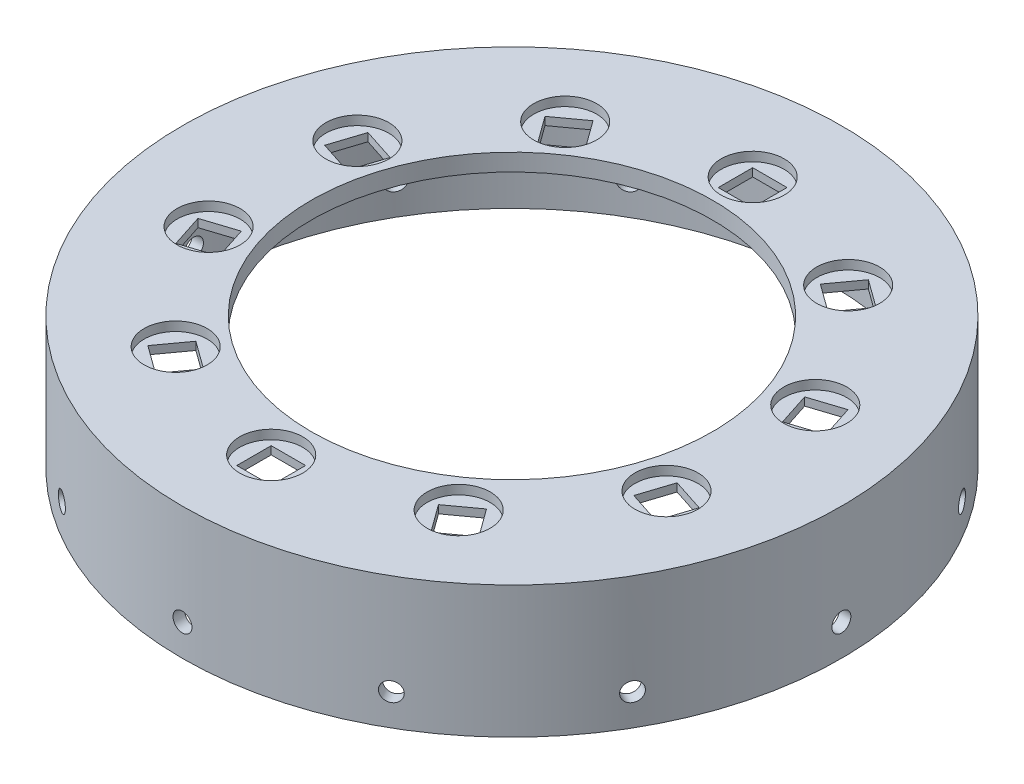
from build123d import *

# Parameters (mm, degrees)
SKETCH1_R           = 57.5
SKETCH1_R_2         = 55.5
BOSS_EXTRUDE1_DEPTH = 20
SKETCH2_R           = 57.5
SKETCH2_R_2         = 35
BOSS_EXTRUDE2_DEPTH = 3
SKETCH3_R           = 5.5
CUT_EXTRUDE1_DEPTH  = 1.6
SKETCH4_W           = 6
SKETCH4_H           = 6
CUT_EXTRUDE2_DEPTH  = 85.086027377
CIRPATTERN1_COUNT   = 10
SKETCH5_R           = 1.65
CUT_EXTRUDE3_DEPTH  = 85.507396126
CIRPATTERN2_COUNT   = 12
FILLET1_R           = 1


with BuildPart() as part:
    # Sketch1 → Boss-Extrude1 (new body)
    with BuildSketch(Plane(origin=(0, 0, 0), x_dir=(1, 0, 0), z_dir=(0, 1, 0))):
        with Locations(Location((0, 0, 0), (0, 0, 270))):
            Circle(SKETCH1_R)
        with Locations(Location((0, 0, 0), (0, 0, 270))):
            Circle(SKETCH1_R_2, mode=Mode.SUBTRACT)
    extrude(amount=BOSS_EXTRUDE1_DEPTH)

    # Sketch2 → Boss-Extrude2 (add)
    with BuildSketch(Plane(origin=(0, 20, 0), x_dir=(1, 0, 0), z_dir=(0, 1, 0))):
        with Locations(Location((0, 0, 0), (0, 0, 270))):
            Circle(SKETCH2_R)
        with Locations(Location((0, 0, 0), (0, 0, 270))):
            Circle(SKETCH2_R_2, mode=Mode.SUBTRACT)
    extrude(amount=BOSS_EXTRUDE2_DEPTH)

    # Sketch3 → Cut-Extrude1 (cut)
    with BuildSketch(Plane(origin=(0, 23, 0), x_dir=(1, 0, 0), z_dir=(0, 1, 0))):
        with Locations(Location((0, -42, 0), (0, 0, 270))):
            Circle(SKETCH3_R)
    cut_extrude1 = extrude(amount=-CUT_EXTRUDE1_DEPTH, mode=Mode.SUBTRACT)

    # Sketch4 → Cut-Extrude2 (cut, through all)
    with BuildSketch(Plane(origin=(0, 21.4, 0), x_dir=(1, 0, 0), z_dir=(0, 1, 0))):
        with Locations((0, -42)):
            Rectangle(SKETCH4_W, SKETCH4_H)
    cut_extrude2 = extrude(amount=-CUT_EXTRUDE2_DEPTH, mode=Mode.SUBTRACT)

    # CirPattern1: Cut-Extrude1, Cut-Extrude2 ×10 about axis
    cirpattern1_axis = Axis((0, 0, 0), (0, 1, 0))
    add([cut_extrude1.rotate(cirpattern1_axis, i * 360 / CIRPATTERN1_COUNT) for i in range(1, CIRPATTERN1_COUNT)], mode=Mode.SUBTRACT)
    add([cut_extrude2.rotate(cirpattern1_axis, i * 360 / CIRPATTERN1_COUNT) for i in range(1, CIRPATTERN1_COUNT)], mode=Mode.SUBTRACT)

    # Sketch5 → Cut-Extrude3 (cut, through all)
    with BuildSketch(Plane.XY):
        with Locations(Location((0, 5.5, 0), (0, 0, 90))):
            Circle(SKETCH5_R)
    cut_extrude3 = extrude(amount=-CUT_EXTRUDE3_DEPTH, mode=Mode.SUBTRACT)

    # CirPattern2: Cut-Extrude3 ×12 about axis
    cirpattern2_axis = Axis((0, 20, 0), (0, -1, 0))
    for i in range(1, CIRPATTERN2_COUNT):
        add(cut_extrude3.rotate(cirpattern2_axis, i * 360 / CIRPATTERN2_COUNT), mode=Mode.SUBTRACT)

    # Fillet1
    fillet1_edges = [part.edges().sort_by_distance(p)[0] for p in [
        (0, 20, -55.5),
    ]]
    fillet(fillet1_edges, radius=FILLET1_R)


solid = part.part
